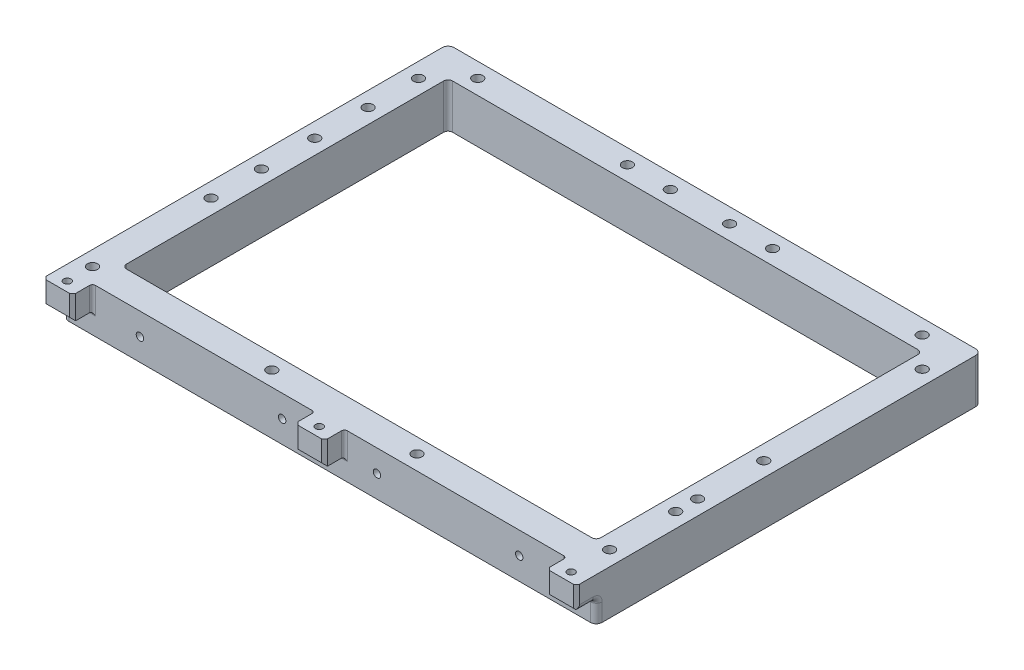
from build123d import *

# Parameters (mm, degrees)
SKETCH1_W                        = 228.6
SKETCH1_H                        = 165.1
SKETCH1_W_2                      = 203.2
SKETCH1_H_2                      = 139.7
FRAME_DEPTH                      = 19.05
SKETCH2_R                        = 2.159
FRONTWALL_MOUNTINGHOLES_DEPTH    = 7.112
SKETCH3_W                        = 12.7
SKETCH3_H                        = 10.16
BOSS_EXTRUDE2_DEPTH              = 8.89
SKETCH4_R                        = 1.5875
CUT_EXTRUDE2_DEPTH               = 148.609844184
SKETCH5_R                        = 1.5875
CUT_EXTRUDE3_DEPTH               = 12.7
FILLET3_R                        = 1.905
SKETCH6_R                        = 2.159
LINKAGE_RHS_MOUNTINGHOLES_DEPTH  = 7.112
SKETCH7_R                        = 2.159
LINKAGE_LHS_MOUNTINGHOLES_DEPTH  = 7.112
SKETCH11_W                       = 12.7
SKETCH11_H                       = 10.16
CUT_EXTRUDE6_DEPTH               = 0.381
FILLET2_R                        = 1.27
CHAMFER1_SIZE                    = 1.27
SKETCH12_R                       = 2.159
CASTER_WHEEL_MOUNT_DEPTH         = 7.112
SKETCH13_R                       = 2.159
FRONTBRACE_MOUNT_DEPTH           = 7.112
SKETCH14_R                       = 2.159
USB_HUB_SWITCH_MOUNT_HOLES_DEPTH = 7.112
FILLET4_R                        = 2.54


with BuildPart() as part:
    # Sketch1 → Frame (new body)
    with BuildSketch(Plane(origin=(0, 0, 0), x_dir=(1, 0, 0), z_dir=(0, 1, 0))):
        Rectangle(SKETCH1_W, SKETCH1_H)
        Rectangle(SKETCH1_W_2, SKETCH1_H_2, mode=Mode.SUBTRACT)
    extrude(amount=FRAME_DEPTH)

    # Sketch2 → FrontWall_mountingHoles (cut)
    with BuildSketch(Plane(origin=(0, 19.05, 0), x_dir=(1, 0, 0), z_dir=(0, 1, 0))):
        with Locations(Location((-95.25, 76.2, 0), (0, 0, 270))):
            Circle(SKETCH2_R)
        with Locations(Location((-107.95, 63.5, 0), (0, 0, 270))):
            Circle(SKETCH2_R)
        with Locations(Location((95.25, 76.2, 0), (0, 0, 90))):
            Circle(SKETCH2_R)
        with Locations(Location((107.95, 63.5, 0), (0, 0, 90))):
            Circle(SKETCH2_R)
    extrude(amount=-FRONTWALL_MOUNTINGHOLES_DEPTH, mode=Mode.SUBTRACT)

    # Sketch3 → Boss-Extrude2 (add)
    with BuildSketch(Plane.XY.offset(82.55)):
        with Locations((107.95, 13.97)):
            Rectangle(SKETCH3_W, SKETCH3_H)
        with Locations((0, 13.97)):
            Rectangle(SKETCH3_W, SKETCH3_H)
        with Locations((-107.95, 13.97)):
            Rectangle(SKETCH3_W, SKETCH3_H)
    extrude(amount=BOSS_EXTRUDE2_DEPTH)

    # Sketch4 → Cut-Extrude2 (cut, through all)
    with BuildSketch(Plane(origin=(0, 19.05, 0), x_dir=(1, 0, 0), z_dir=(0, 1, 0))):
        with Locations(Location((-107.95, -86.995, 0), (0, 0, 270))):
            Circle(SKETCH4_R)
        with Locations(Location((0, -86.995, 0), (0, 0, 270))):
            Circle(SKETCH4_R)
        with Locations(Location((107.95, -86.995, 0), (0, 0, 270))):
            Circle(SKETCH4_R)
    extrude(amount=-CUT_EXTRUDE2_DEPTH, mode=Mode.SUBTRACT)

    # Sketch5 → Cut-Extrude3 (cut)
    with BuildSketch(Plane.XY.offset(82.55)):
        with Locations((-20.32, 9.525)):
            Circle(SKETCH5_R)
        with Locations((-81.28, 9.525)):
            Circle(SKETCH5_R)
        with Locations(Location((81.28, 9.525, 0), (0, 0, 180))):
            Circle(SKETCH5_R)
        with Locations(Location((20.32, 9.525, 0), (0, 0, 180))):
            Circle(SKETCH5_R)
    extrude(amount=-CUT_EXTRUDE3_DEPTH, mode=Mode.SUBTRACT)

    # Fillet3
    fillet3_edges = [part.edges().sort_by_distance(p)[0] for p in [
        (101.6, 9.525, 69.85),
        (101.6, 9.525, -69.85),
        (-101.6, 9.525, -69.85),
        (-101.6, 9.525, 69.85),
    ]]
    fillet(fillet3_edges, radius=FILLET3_R)

    # Sketch6 → Linkage_RHS_MountingHoles (cut)
    with BuildSketch(Plane(origin=(0, 19.05, 0), x_dir=(1, 0, 0), z_dir=(0, 1, 0))):
        with Locations(Location((107.95, -4.445, 0), (0, 0, 270))):
            Circle(SKETCH6_R)
        with Locations(Location((107.95, -32.766, 0), (0, 0, 270))):
            Circle(SKETCH6_R)
        with Locations(Location((107.95, -42.164, 0), (0, 0, 270))):
            Circle(SKETCH6_R)
        with Locations(Location((107.95, -70.485, 0), (0, 0, 270))):
            Circle(SKETCH6_R)
    extrude(amount=-LINKAGE_RHS_MOUNTINGHOLES_DEPTH, mode=Mode.SUBTRACT)

    # Sketch7 → Linkage-LHS-MountingHoles (cut)
    with BuildSketch(Plane(origin=(0, 19.05, 0), x_dir=(1, 0, 0), z_dir=(0, 1, 0))):
        with Locations(Location((-107.95, 41.91, 0), (0, 0, 270))):
            Circle(SKETCH7_R)
        with Locations(Location((-107.95, 19.05, 0), (0, 0, 270))):
            Circle(SKETCH7_R)
        with Locations(Location((-107.95, -3.81, 0), (0, 0, 270))):
            Circle(SKETCH7_R)
    extrude(amount=-LINKAGE_LHS_MOUNTINGHOLES_DEPTH, mode=Mode.SUBTRACT)

    # Sketch11 → Cut-Extrude6 (cut)
    with BuildSketch(Plane.XY.offset(91.44)):
        with Locations((-107.95, 13.97)):
            Rectangle(SKETCH11_W, SKETCH11_H)
        with Locations((0, 13.97)):
            Rectangle(SKETCH11_W, SKETCH11_H)
        with Locations((107.95, 13.97)):
            Rectangle(SKETCH11_W, SKETCH11_H)
    extrude(amount=-CUT_EXTRUDE6_DEPTH, mode=Mode.SUBTRACT)

    # Fillet2
    fillet2_edges = [part.edges().sort_by_distance(p)[0] for p in [
        (101.6, 13.97, 82.55),
        (107.95, 8.89, 82.55),
        (-107.95, 8.89, 82.55),
        (-101.6, 13.97, 82.55),
        (6.35, 13.97, 82.55),
        (-6.35, 13.97, 82.55),
        (0, 8.89, 82.55),
    ]]
    fillet(fillet2_edges, radius=FILLET2_R)

    # Chamfer1
    chamfer1_edges = [part.edges().sort_by_distance(p)[0] for p in [
        (-114.3, 13.97, 91.059),
        (-101.6, 13.97, 91.059),
        (-107.95, 8.89, 91.059),
        (0, 8.89, 91.059),
        (-6.35, 13.97, 91.059),
        (6.35, 13.97, 91.059),
        (107.95, 8.89, 91.059),
        (101.6, 13.97, 91.059),
        (114.3, 13.97, 91.059),
    ]]
    chamfer(chamfer1_edges, length=CHAMFER1_SIZE)

    # Sketch12 → Caster_Wheel_Mount (cut)
    with BuildSketch(Plane(origin=(0, 19.05, 0), x_dir=(1, 0, 0), z_dir=(0, 1, 0))):
        with Locations(Location((-31.115, 76.2, 0), (0, 0, 270))):
            Circle(SKETCH12_R)
        with Locations(Location((31.115, 76.2, 0), (0, 0, 90))):
            Circle(SKETCH12_R)
        with Locations(Location((31.115, -76.2, 0), (0, 0, 270))):
            Circle(SKETCH12_R)
        with Locations(Location((-31.115, -76.2, 0), (0, 0, 90))):
            Circle(SKETCH12_R)
    extrude(amount=-CASTER_WHEEL_MOUNT_DEPTH, mode=Mode.SUBTRACT)

    # Sketch13 → FrontBrace_Mount (cut)
    with BuildSketch(Plane(origin=(0, 19.05, 0), x_dir=(1, 0, 0), z_dir=(0, 1, 0))):
        with Locations(Location((-12.7, 76.2, 0), (0, 0, 270))):
            Circle(SKETCH13_R)
        with Locations(Location((12.7, 76.2, 0), (0, 0, 90))):
            Circle(SKETCH13_R)
    extrude(amount=-FRONTBRACE_MOUNT_DEPTH, mode=Mode.SUBTRACT)

    # Sketch14 → USB_HUB_Switch_Mount_Holes (cut)
    with BuildSketch(Plane(origin=(0, 19.05, 0), x_dir=(1, 0, 0), z_dir=(0, 1, 0))):
        with Locations(Location((-107.95, -25.4, 0), (0, 0, 270))):
            Circle(SKETCH14_R)
        with Locations(Location((-107.95, -76.2, 0), (0, 0, 90))):
            Circle(SKETCH14_R)
    extrude(amount=-USB_HUB_SWITCH_MOUNT_HOLES_DEPTH, mode=Mode.SUBTRACT)

    # Fillet4
    fillet4_edges = [part.edges().sort_by_distance(p)[0] for p in [
        (-114.3, 3.81, 82.55),
        (114.3, 3.81, 82.55),
        (114.3, 8.518025612, 82.921974388),
        (-114.3, 8.518025612, 82.921974388),
        (114.3, 8.89, 86.8045),
        (-114.3, 8.89, 86.8045),
        (-114.3, 9.525, -82.55),
        (114.3, 9.525, -82.55),
    ]]
    fillet(fillet4_edges, radius=FILLET4_R)


solid = part.part
